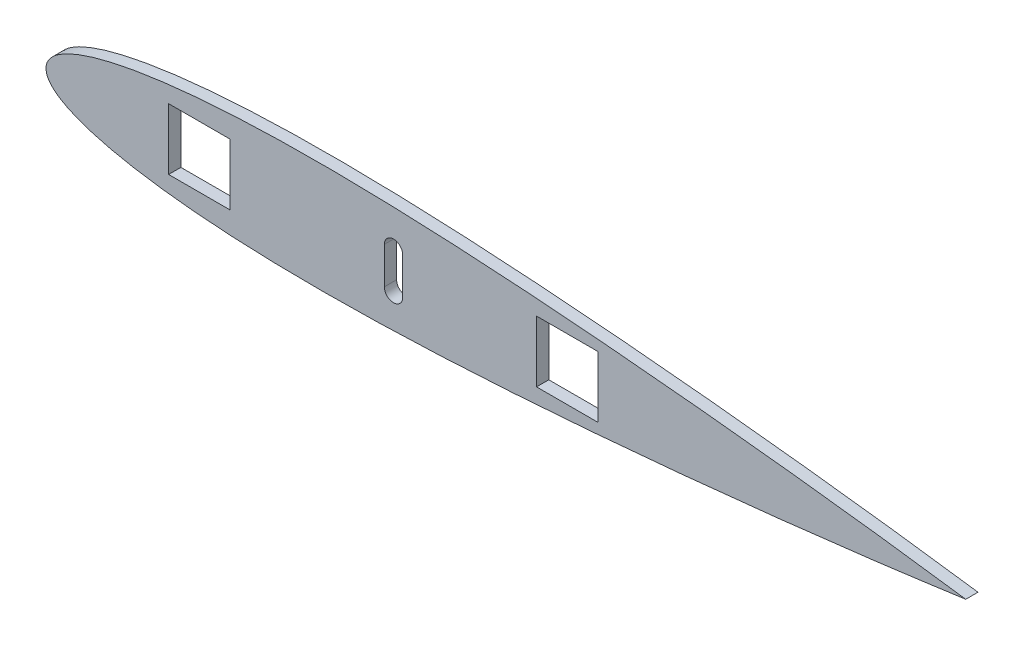
from build123d import *

# Parameters (mm, degrees)
BOSS_EXTRUDE1_DEPTH = 2
SKETCH2_W           = 10
SKETCH2_H           = 10
CUT_EXTRUDE1_DEPTH  = 2
CUT_EXTRUDE2_DEPTH  = 2


with BuildPart() as part:
    # Sketch1 → Boss-Extrude1 (new body)
    with BuildSketch(Plane.XY):
        with BuildLine():
            add(Edge.make_bspline(
                [(0, 0), (0.017737679, 0.21563179), (0.054124727, 0.657978531), (0.343214492, 1.298862569), (0.793518335, 1.915453085), (1.418593739, 2.510411621), (2.210440726, 3.08584076), (3.169840337, 3.64229027), (4.294762462, 4.179129104), (5.583413569, 4.69513941), (7.033172592, 5.188783743), (8.640964446, 5.658406049), (11.080866503, 6.272892351), (14.502446863, 6.955454069), (19.033265173, 7.627780104), (24.084738243, 8.169485105), (29.61030038, 8.573350569), (36.653446176, 8.884204814), (45.268552866, 8.994485881), (55.449246929, 8.823980559), (67.247179838, 8.346573268), (80.384127491, 7.524875895), (94.475089666, 6.381384792), (108.784193237, 5.015612692), (123.127907022, 3.461297117), (136.57914049, 1.828195781), (145.420848795, 0.64480177), (149.505193273, 0.070051229), (149.970810304, 0.00413247), (150, 0)],
                knots=[0, 0, 0, 0, 0.004217542, 0.008651859, 0.013562306, 0.019137014, 0.025499556, 0.032726168, 0.040861643, 0.049929832, 0.059940125, 0.070891981, 0.082777029, 0.109285667, 0.139301078, 0.172602407, 0.208924358, 0.247964735, 0.310881146, 0.377906083, 0.447678538, 0.542484027, 0.636086648, 0.724985379, 0.824439816, 0.919092539, 0.990775422, 0.999421708, 1, 1, 1, 1], degree=3))
            add(Edge.make_bspline(
                [(0, 0), (0.017737679, -0.21563179), (0.054124727, -0.657978531), (0.343214492, -1.298862569), (0.793518335, -1.915453085), (1.418593739, -2.510411621), (2.210440726, -3.08584076), (3.169840337, -3.64229027), (4.294762462, -4.179129104), (5.583413569, -4.69513941), (7.033172592, -5.188783743), (8.640964446, -5.658406049), (11.080866503, -6.272892351), (14.502446863, -6.955454069), (19.033265173, -7.627780104), (24.084738243, -8.169485105), (29.61030038, -8.573350569), (36.653446176, -8.884204814), (45.268552866, -8.994485881), (55.449246929, -8.823980559), (67.247179838, -8.346573268), (80.384127491, -7.524875895), (94.475089666, -6.381384792), (108.784193237, -5.015612692), (123.127907022, -3.461297117), (136.57914049, -1.828195781), (145.420848795, -0.64480177), (149.505193273, -0.070051229), (149.970810304, -0.00413247), (150, 0)],
                knots=[0, 0, 0, 0, 0.004217542, 0.008651859, 0.013562306, 0.019137014, 0.025499556, 0.032726168, 0.040861643, 0.049929832, 0.059940125, 0.070891981, 0.082777029, 0.109285667, 0.139301078, 0.172602407, 0.208924358, 0.247964735, 0.310881146, 0.377906083, 0.447678538, 0.542484027, 0.636086648, 0.724985379, 0.824439816, 0.919092539, 0.990775422, 0.999421708, 1, 1, 1, 1], degree=3))
        make_face()
    extrude(amount=BOSS_EXTRUDE1_DEPTH)

    # Sketch2 → Cut-Extrude1 (cut)
    with BuildSketch(Plane.XY.offset(2)):
        with Locations((25, 0)):
            Rectangle(SKETCH2_W, SKETCH2_H)
        with Locations((85, 0)):
            Rectangle(SKETCH2_W, SKETCH2_H)
    extrude(amount=-CUT_EXTRUDE1_DEPTH, mode=Mode.SUBTRACT)

    # Sketch3 → Cut-Extrude2 (cut)
    with BuildSketch(Plane.XY.offset(2)):
        with BuildLine():
            Line((55.177854161, -3.279241302), (55.177854161, 2.721162631))
            ThreePointArc((55.177854161, 2.721162631), (56.677955144, 4.221263615), (58.178056128, 2.721162631))
            Line((58.178056128, 2.721162631), (58.178056128, -3.279241302))
            ThreePointArc((58.178056128, -3.279241302), (56.677955144, -4.779342285), (55.177854161, -3.279241302))
        make_face()
    extrude(amount=-CUT_EXTRUDE2_DEPTH, mode=Mode.SUBTRACT)


solid = part.part
